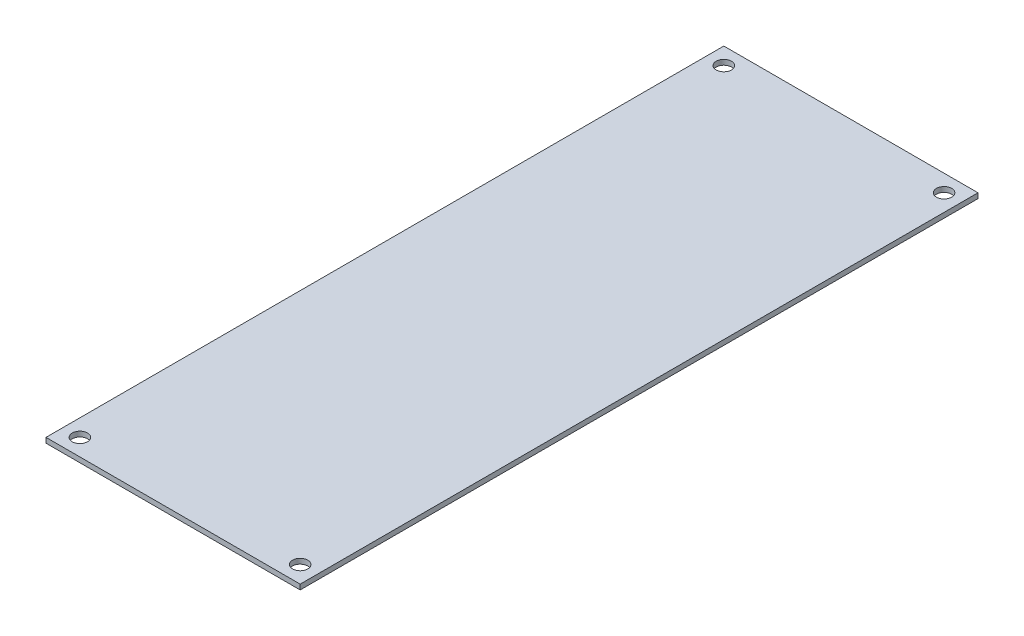
from build123d import *

# Parameters (mm, degrees)
SKETCH1_W               = 75
SKETCH1_H               = 200
BOSS_EXTRUDE1_DEPTH     = 0.75
CUT_EXTRUDE1_DEPTH      = 214.60536042
CUT_EXTRUDE1_DEPTH_BACK = 214.60536042
SKETCH2_R               = 2.25


with BuildPart() as part:
    # Sketch1 → Boss-Extrude1 (new, symmetric)
    with BuildSketch(Plane(origin=(0, 0, 0), x_dir=(1, 0, 0), z_dir=(0, 1, 0))):
        with Locations((37.5, 100)):
            Rectangle(SKETCH1_W, SKETCH1_H)
    extrude(amount=BOSS_EXTRUDE1_DEPTH, both=True)

    # Sketch2 → Cut-Extrude1 (cut, two sides: drawn at the far end of the back side and taken through both)
    with BuildSketch(Plane(origin=(0, 0.75, 0), x_dir=(1, 0, 0), z_dir=(0, 1, 0)).offset(-CUT_EXTRUDE1_DEPTH_BACK)):
        with Locations(Location((5, 195, 0), (0, 0, 270))):
            Circle(SKETCH2_R)
        with Locations(Location((70, 195, 0), (0, 0, 270))):
            Circle(SKETCH2_R)
        with Locations(Location((5, 5, 0), (0, 0, 270))):
            Circle(SKETCH2_R)
        with Locations(Location((70, 5, 0), (0, 0, 270))):
            Circle(SKETCH2_R)
    extrude(amount=CUT_EXTRUDE1_DEPTH + CUT_EXTRUDE1_DEPTH_BACK, mode=Mode.SUBTRACT)


solid = part.part
